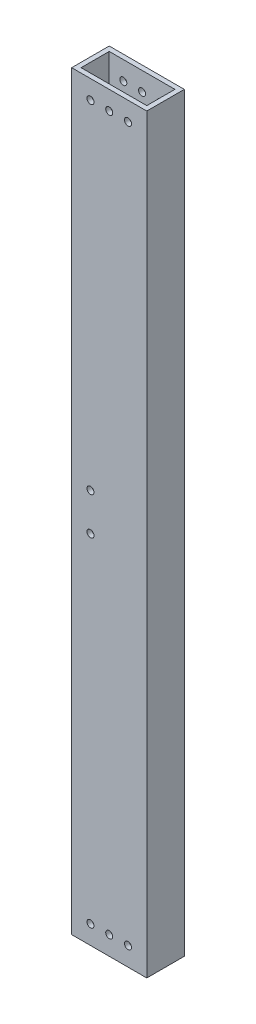
from build123d import *

# Parameters (mm, degrees)
SKETCH1_W           = 50.8
SKETCH1_H           = 25.4
BOSS_EXTRUDE1_DEPTH = 254
SHELL1_T            = -3.175
SKETCH2_R           = 2.38125
CUT_EXTRUDE1_DEPTH  = 257.527425434
SKETCH3_R           = 2.38125
CUT_EXTRUDE2_DEPTH  = 257.527425434


with BuildPart() as part:
    # Sketch1 → Boss-Extrude1 (new, symmetric)
    with BuildSketch(Plane(origin=(0, 0, 0), x_dir=(1, 0, 0), z_dir=(0, 1, 0))):
        Rectangle(SKETCH1_W, SKETCH1_H)
    extrude(amount=BOSS_EXTRUDE1_DEPTH, both=True)

    # Shell1
    shell1_openings = [part.faces().sort_by_distance(p)[0] for p in [
        (0, 254, 0),
        (0, -254, 0),
    ]]
    offset(amount=SHELL1_T, openings=shell1_openings, kind=Kind.INTERSECTION)

    # Sketch2 → Cut-Extrude1 (cut, through all)
    with BuildSketch(Plane(origin=(0, 0, -12.7), x_dir=(-1, 0, 0), z_dir=(0, 0, -1))):
        with Locations((12.7, -12.7)):
            Circle(SKETCH2_R)
        with Locations((12.7, 12.7)):
            Circle(SKETCH2_R)
    extrude(amount=-CUT_EXTRUDE1_DEPTH, mode=Mode.SUBTRACT)

    # Sketch3 → Cut-Extrude2 (cut, through all)
    with BuildSketch(Plane(origin=(0, 0, -12.7), x_dir=(-1, 0, 0), z_dir=(0, 0, -1))):
        with Locations((0, -241.3)):
            Circle(SKETCH3_R)
        with Locations((12.7, -241.3)):
            Circle(SKETCH3_R)
        with Locations((-12.7, -241.3)):
            Circle(SKETCH3_R)
        with Locations((-12.7, 241.3)):
            Circle(SKETCH3_R)
        with Locations((12.7, 241.3)):
            Circle(SKETCH3_R)
        with Locations((0, 241.3)):
            Circle(SKETCH3_R)
    extrude(amount=-CUT_EXTRUDE2_DEPTH, mode=Mode.SUBTRACT)


solid = part.part
